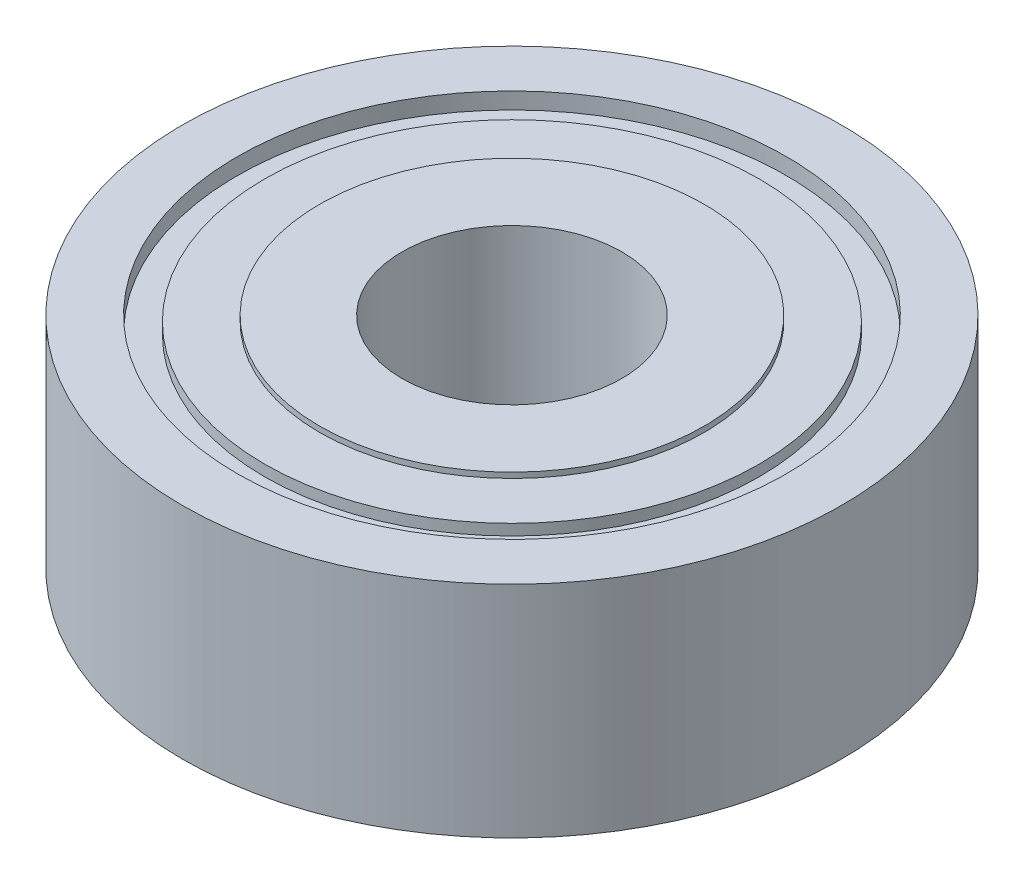
from build123d import *

# Parameters (mm, degrees)
SKETCH1_R           = 7
SKETCH1_R_2         = 4
BOSS_EXTRUDE1_DEPTH = 4
SKETCH3_R           = 9
SKETCH3_R_2         = 7
BOSS_EXTRUDE2_DEPTH = 3.8
SKETCH4_R           = 10
SKETCH4_R_2         = 9
BOSS_EXTRUDE3_DEPTH = 3.4
SKETCH5_R           = 12
SKETCH5_R_2         = 10
BOSS_EXTRUDE4_DEPTH = 4


with BuildPart() as part:
    # Sketch1 → Boss-Extrude1 (new, symmetric)
    with BuildSketch(Plane(origin=(0, 0, 0), x_dir=(1, 0, 0), z_dir=(0, 1, 0))):
        with Locations(Location((0, 0, 0), (0, 0, 270))):
            Circle(SKETCH1_R)
        with Locations(Location((0, 0, 0), (0, 0, 270))):
            Circle(SKETCH1_R_2, mode=Mode.SUBTRACT)
    extrude(amount=BOSS_EXTRUDE1_DEPTH, both=True)

    # Sketch3 → Boss-Extrude2 (add, symmetric)
    with BuildSketch(Plane(origin=(0, 0, 0), x_dir=(1, 0, 0), z_dir=(0, 1, 0))):
        with Locations(Location((0, 0, 0), (0, 0, 90))):
            Circle(SKETCH3_R)
        with Locations(Location((0, 0, 0), (0, 0, 270))):
            Circle(SKETCH3_R_2, mode=Mode.SUBTRACT)
    extrude(amount=BOSS_EXTRUDE2_DEPTH, both=True)

    # Sketch4 → Boss-Extrude3 (add, symmetric)
    with BuildSketch(Plane(origin=(0, 0, 0), x_dir=(1, 0, 0), z_dir=(0, 1, 0))):
        with Locations(Location((0, 0, 0), (0, 0, 270))):
            Circle(SKETCH4_R)
        with Locations(Location((0, 0, 0), (0, 0, 90))):
            Circle(SKETCH4_R_2, mode=Mode.SUBTRACT)
    extrude(amount=BOSS_EXTRUDE3_DEPTH, both=True)

    # Sketch5 → Boss-Extrude4 (add, symmetric)
    with BuildSketch(Plane(origin=(0, 0, 0), x_dir=(1, 0, 0), z_dir=(0, 1, 0))):
        with Locations(Location((0, 0, 0), (0, 0, 270))):
            Circle(SKETCH5_R)
        with Locations(Location((0, 0, 0), (0, 0, 270))):
            Circle(SKETCH5_R_2, mode=Mode.SUBTRACT)
    extrude(amount=BOSS_EXTRUDE4_DEPTH, both=True)


solid = part.part
